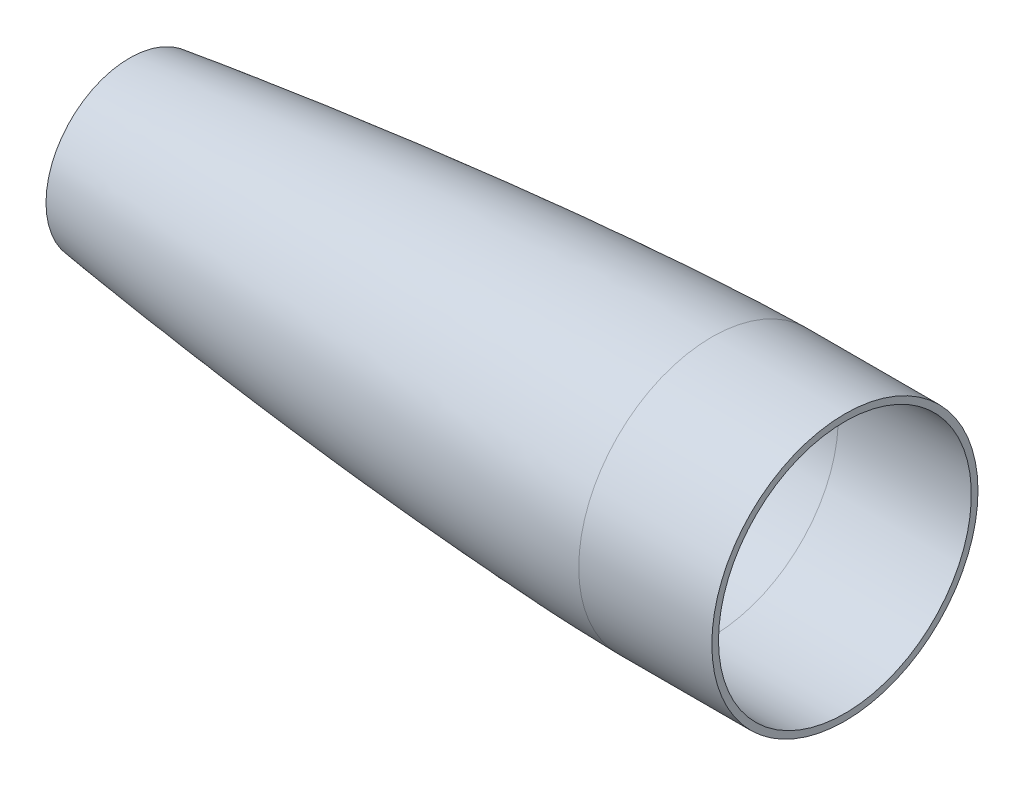
from build123d import *

# Parameters (mm, degrees)
SKETCH3_R          = 3.1
CUT_EXTRUDE1_DEPTH = 223.31734079


with BuildPart() as part:
    # Sketch2 → Revolve1 (revolve)
    with BuildSketch(Plane.XY, mode=Mode.PRIVATE) as revolve1_sk:
        with BuildLine():
            add(Edge.make_bspline(
                [(125, 23.102487634), (125.666615155, 23.191427334), (126.333282144, 23.280003056), (127, 23.368217816)],
                knots=[0.42027122, 0.42027122, 0.42027122, 0.42027122, 0.426924824, 0.426924824, 0.426924824, 0.426924824], degree=3))
            Line((125, 23.102487634), (125, 0))
            Line((125, 0), (127, 0))
            Line((127, 0), (127, 23.368217816))
        make_face()
        with BuildLine():
            add(Edge.make_bspline(
                [(125, 25.120191193), (127.332751625, 25.431081941), (132.331407151, 26.087565456), (140.331004574, 27.10588444), (148.997541828, 28.170567532), (157.997673527, 29.234895992), (166.997785275, 30.258604093), (175.99788006, 31.242125821), (184.997960367, 32.185617854), (193.998028035, 33.088962248), (202.664954428, 33.919819428), (210.99851948, 34.682629582), (218.665386436, 35.352459035), (225.998901833, 35.963660277), (232.998913298, 36.519926308), (239.665734713, 37.022853053), (245.999211125, 37.475811811), (251.666003322, 37.85960313), (256.999453321, 38.201234754), (261.666221352, 38.483732538), (265.999648607, 38.731455183), (269.999647247, 38.947445799), (273.66639347, 39.133060543), (276.999799587, 39.291194487), (279.999798447, 39.424786884), (282.666524002, 39.535197061), (284.999909378, 39.625181506), (286.99990888, 39.697455867), (288.999908328, 39.764500704), (290.666612895, 39.815618833), (292.333279241, 39.862775866), (293.666612296, 39.897137908), (294.999976548, 39.927604539), (295.999976496, 39.948292861), (296.999976131, 39.96663039), (297.999976806, 39.981991095), (298.999972804, 39.99470952), (299.666663128, 39.998236536), (300, 40)],
                knots=[0.421150249, 0.421150249, 0.421150249, 0.421150249, 0.444408212, 0.470975106, 0.5008465, 0.530701571, 0.560541205, 0.590366151, 0.620177045, 0.649974425, 0.679758747, 0.706223046, 0.732677549, 0.755817349, 0.778949888, 0.802075245, 0.821891307, 0.841702158, 0.85820723, 0.874708692, 0.88790726, 0.901103509, 0.914297431, 0.924191338, 0.934083923, 0.943975179, 0.950568607, 0.957161437, 0.963753667, 0.970345292, 0.973640877, 0.980231589, 0.983526714, 0.986821685, 0.9901165, 0.99341116, 0.996705662, 1, 1, 1, 1], degree=3))
            Line((125, 25.120191193), (125, 23.102487634))
            add(Edge.make_bspline(
                [(125, 23.102487634), (125.666615155, 23.191427334), (126.333282144, 23.280003056), (127, 23.368217816)],
                knots=[0.42027122, 0.42027122, 0.42027122, 0.42027122, 0.426924824, 0.426924824, 0.426924824, 0.426924824], degree=3))
            add(Edge.make_bspline(
                [(127, 23.368217816), (128.56568768, 23.575377055), (135.88942536, 24.534911993), (155.75679736, 27.020093999), (186.647560948, 30.453496137), (218.103688818, 33.367517534), (243.296405578, 35.313318367), (262.204681004, 36.552540592), (277.964515807, 37.369612833), (290.582066888, 37.830985967), (296.865005199, 37.983386836), (300.010580524, 38.000027987)],
                knots=[0.426924824, 0.426924824, 0.426924824, 0.426924824, 0.442549824, 0.5, 0.625, 0.75, 0.8125, 0.875, 0.9375, 0.96875, 1, 1, 1, 1], degree=3))
            Line((300.010580524, 38.000027987), (340, 38.000027987))
            Line((340, 38.000027987), (340, 40))
            Line((340, 40), (300, 40))
        make_face()
    revolve(revolve1_sk.sketch.rotate(Axis((0, 0, 0), (1, 0, 0)), 90), axis=Axis((0, 0, 0), (1, 0, 0)))

    # Sketch3 → Cut-Extrude1 (cut, through all)
    with BuildSketch(Plane.ZY.offset(-125)):
        Circle(SKETCH3_R)
    extrude(amount=-CUT_EXTRUDE1_DEPTH, mode=Mode.SUBTRACT)


solid = part.part
